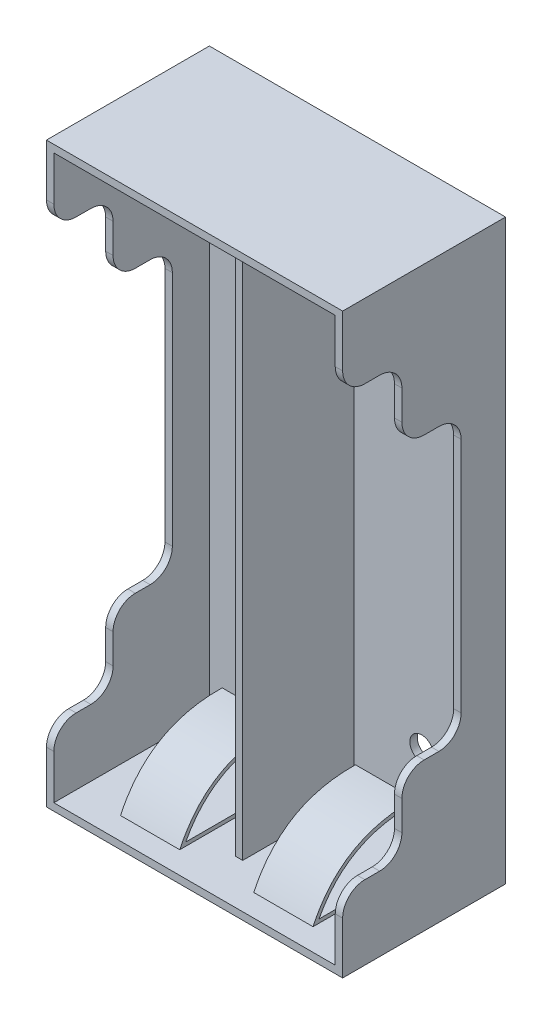
from build123d import *

# Parameters (mm, degrees)
SKETCH1_W           = 40
SKETCH1_H           = 78
BOSS_EXTRUDE1_DEPTH = 22
SHELL1_T            = -1
CUT_EXTRUDE1_REACH  = 92.377
FILLET1_R           = 3
BOSS_EXTRUDE2_DEPTH = 13
CUT_EXTRUDE2_REACH  = 92.377
SKETCH4_W           = 10
SKETCH4_H           = 10
SKETCH6_W           = 1
SKETCH6_H           = 76
BOSS_EXTRUDE3_DEPTH = 15
SKETCH7_R           = 1.6
CUT_EXTRUDE3_DEPTH  = 15


with BuildPart() as part:
    # Sketch1 → Boss-Extrude1 (new body)
    with BuildSketch(Plane.XY):
        with Locations((20, 39)):
            Rectangle(SKETCH1_W, SKETCH1_H)
    extrude(amount=BOSS_EXTRUDE1_DEPTH)

    # Shell1
    shell1_openings = [part.faces().sort_by_distance(p)[0] for p in [
        (20, 39, 22),
    ]]
    offset(amount=SHELL1_T, openings=shell1_openings, kind=Kind.INTERSECTION)

    # Cut-Extrude1: up to this face of the body (flat: up to its plane)
    cut_extrude1_end = Plane(part.part.faces().sort_by_distance((0, 39, 11))[0])
    # Sketch2 → Cut-Extrude1 (cut, up to the picked face)
    with BuildSketch(Plane(origin=(40, 0, 0), x_dir=(0, 0, -1), z_dir=(1, 0, 0)), mode=Mode.PRIVATE) as cut_extrude1_sk1:
        Polygon((-22, 10), (-14, 10), (-14, 20), (-6, 20), (-6, 58), (-14, 58), (-14, 68), (-22, 68), align=None)
    cut_extrude1_tool1 = split(extrude(cut_extrude1_sk1.sketch, amount=-CUT_EXTRUDE1_REACH, mode=Mode.PRIVATE), bisect_by=cut_extrude1_end, keep=Keep.BOTH, mode=Mode.PRIVATE)
    add(cut_extrude1_tool1.solids().sort_by(Axis((40, 39, 14.833333), (-1, 0, 0)))[0], mode=Mode.SUBTRACT)

    # Fillet1
    fillet1_edges = [part.edges().sort_by_distance(p)[0] for p in [
        (0.5, 10, 22),
        (0.5, 68, 22),
        (0.5, 68, 14),
        (0.5, 58, 14),
        (0.5, 58, 6),
        (0.5, 20, 6),
        (0.5, 20, 14),
        (0.5, 10, 14),
        (39.5, 10, 22),
        (39.5, 68, 22),
        (39.5, 68, 14),
        (39.5, 58, 14),
        (39.5, 58, 6),
        (39.5, 20, 6),
        (39.5, 20, 14),
        (39.5, 10, 14),
    ]]
    fillet(fillet1_edges, radius=FILLET1_R)

    # Sketch3 → Boss-Extrude2 (add, symmetric)
    with BuildSketch(Plane(origin=(20, 0, 0), x_dir=(0, 0, -1), z_dir=(1, 0, 0))):
        with BuildLine():
            Line((-1, 1), (-19, 1))
            add(Edge.make_bspline(
                [(-19, 1), (-15.129811325, 9.249678545), (-5.265487128, 9.067042822)],
                knots=[0, 0, 0, 1, 1, 1], degree=2))
            Line((-5.265487128, 9.067042822), (-5.274742928, 8.567128499))
            add(Edge.make_bspline(
                [(-18.193150022, 1.5), (-16.753433037, 4.226674383), (-13.159011892, 6.996200729), (-8.728135169, 8.626895855), (-5.274742928, 8.567128499)],
                knots=[0.045482842, 0.045482842, 0.045482842, 0.403426776, 0.642056066, 1, 1, 1], degree=2))
            Line((-18.193150022, 1.5), (-1, 1.5))
            Line((-1, 1.5), (-1, 1))
        make_face()
        with BuildLine():
            Line((-5.274742928, 69.432871501), (-5.265487128, 68.932957178))
            add(Edge.make_bspline(
                [(-19, 77), (-15.129811325, 68.750321455), (-5.265487128, 68.932957178)],
                knots=[0, 0, 0, 1, 1, 1], degree=2))
            Line((-19, 77), (-1, 77))
            Line((-1, 77), (-1, 76.5))
            Line((-1, 76.5), (-18.193150022, 76.5))
            add(Edge.make_bspline(
                [(-18.193150022, 76.5), (-13.692591499, 70.12438977), (-5.274742928, 69.432871501)],
                knots=[0.057815428, 0.057815428, 0.057815428, 1, 1, 1], degree=2))
        make_face()
    extrude(amount=BOSS_EXTRUDE2_DEPTH, both=True)

    # Cut-Extrude2: up to this face of the body (flat: up to its plane)
    cut_extrude2_end = Plane(part.part.faces().sort_by_distance((20, 39, 1))[0])
    # Sketch4 → Cut-Extrude2 (cut, up to the picked face)
    with BuildSketch(Plane.XY.offset(22), mode=Mode.PRIVATE) as cut_extrude2_sk1:
        with Locations((20, 6)):
            Rectangle(SKETCH4_W, SKETCH4_H)
    cut_extrude2_tool1 = split(extrude(cut_extrude2_sk1.sketch, amount=-CUT_EXTRUDE2_REACH, mode=Mode.PRIVATE), bisect_by=cut_extrude2_end, keep=Keep.BOTH, mode=Mode.PRIVATE)
    # Sketch4 → Cut-Extrude2 (cut, up to the picked face)
    with BuildSketch(Plane.XY.offset(22), mode=Mode.PRIVATE) as cut_extrude2_sk2:
        with Locations((20, 72)):
            Rectangle(SKETCH4_W, SKETCH4_H)
    cut_extrude2_tool2 = split(extrude(cut_extrude2_sk2.sketch, amount=-CUT_EXTRUDE2_REACH, mode=Mode.PRIVATE), bisect_by=cut_extrude2_end, keep=Keep.BOTH, mode=Mode.PRIVATE)
    add(cut_extrude2_tool1.solids().sort_by(Axis((20, 6, 22), (0, 0, -1)))[0], mode=Mode.SUBTRACT)
    add(cut_extrude2_tool2.solids().sort_by(Axis((20, 72, 22), (0, 0, -1)))[0], mode=Mode.SUBTRACT)

    # Sketch6 → Boss-Extrude3 (add)
    with BuildSketch(Plane.XY.offset(1)):
        with Locations((20, 39)):
            Rectangle(SKETCH6_W, SKETCH6_H)
    extrude(amount=BOSS_EXTRUDE3_DEPTH)

    # Sketch7 → Cut-Extrude3 (cut)
    with BuildSketch(Plane.XY.offset(1)):
        with Locations((10.325, 11.175)):
            Circle(SKETCH7_R)
        with Locations((10.325, 66.825)):
            Circle(SKETCH7_R)
        with Locations((29.675, 11.175)):
            Circle(SKETCH7_R)
        with Locations((29.675, 66.825)):
            Circle(SKETCH7_R)
    extrude(amount=-CUT_EXTRUDE3_DEPTH, mode=Mode.SUBTRACT)


solid = part.part
